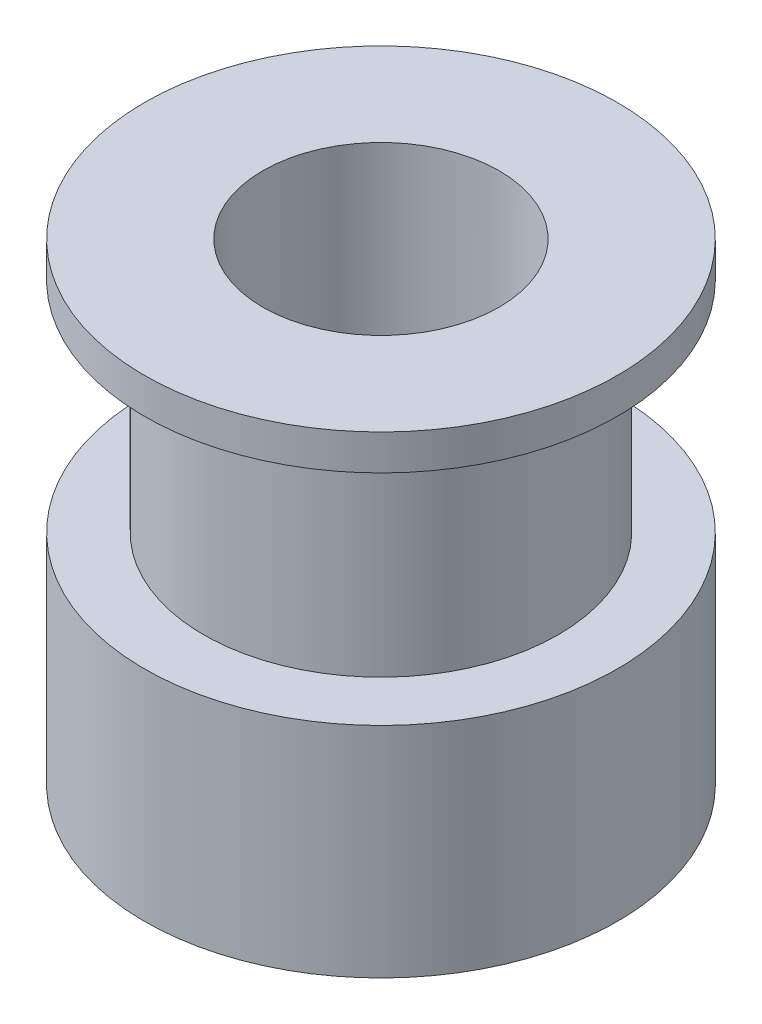
from build123d import *

# Parameters (mm, degrees)
CUT_EXTRUDE1_REACH      = 21.596
SKETCH2_R               = 4
CUT_EXTRUDE2_REACH      = 17.78
CUT_EXTRUDE2_END_RADIUS = 8
SKETCH3_R               = 2
CIRPATTERN1_COUNT       = 2
CIRPATTERN1_ANGLE       = 90


with BuildPart() as part:
    # Sketch1 → Revolve1 (revolve)
    with BuildSketch(Plane.XY):
        Polygon((0, 5), (-8, 5), (-8, 3.8), (-6, 3.8), (-6, -3.6), (-8, -3.6), (-8, -11), (0, -11), align=None)
    revolve(axis=Axis((0, 1004.776363636, 0), (0, -1, 0)))

    # Sketch2 → Cut-Extrude1 (cut, up to next)
    with BuildSketch(Plane(origin=(0, 5, 0), x_dir=(1, 0, 0), z_dir=(0, 1, 0)), mode=Mode.PRIVATE) as cut_extrude1_sk1:
        with Locations(Location((0, 0, 0), (0, 0, 180))):
            Circle(SKETCH2_R)
    cut_extrude1_tool1 = extrude(cut_extrude1_sk1.sketch, amount=-CUT_EXTRUDE1_REACH, mode=Mode.PRIVATE) & part.part
    add(cut_extrude1_tool1.solids().sort_by_distance((0, 5, 0))[0], mode=Mode.SUBTRACT)

    # Cut-Extrude2: up to this cylinder (the profile starts inside it)
    cut_extrude2_end = Plane(origin=(0, -7.3, 0), z_dir=(0, 1, 0)) * Cylinder(CUT_EXTRUDE2_END_RADIUS, 52.56, mode=Mode.PRIVATE)
    # Sketch3 → Cut-Extrude2 (cut, up to the surface)
    with BuildSketch(Plane.XY, mode=Mode.PRIVATE) as cut_extrude2_sk1:
        with Locations((0, -7.3)):
            Circle(SKETCH3_R)
    cut_extrude2_tool1 = extrude(cut_extrude2_sk1.sketch, amount=-CUT_EXTRUDE2_REACH, mode=Mode.PRIVATE) & cut_extrude2_end
    cut_extrude2 = cut_extrude2_tool1.solids().sort_by_distance((0, -7.3, 0))[0]
    add(cut_extrude2, mode=Mode.SUBTRACT)

    # CirPattern1: Cut-Extrude2 ×2 about axis
    cirpattern1_axis = Axis((0, -11, 0), (0, 1, 0))
    for i in range(1, CIRPATTERN1_COUNT):
        add(cut_extrude2.rotate(cirpattern1_axis, i * CIRPATTERN1_ANGLE / (CIRPATTERN1_COUNT - 1)), mode=Mode.SUBTRACT)


solid = part.part
